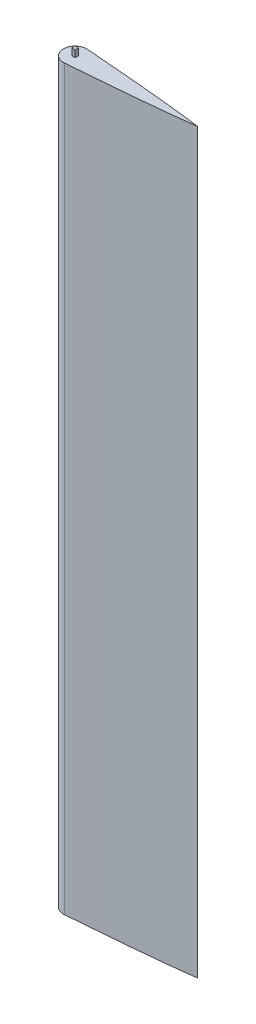
from build123d import *

# Parameters (mm, degrees)
SKETCH_2_W      = 1
SKETCH_2_H      = 1
EXTRUDE_1_DEPTH = 220
EXTRUDE_START   = -2
SKETCH_2_3_W    = 1
SKETCH_2_3_H    = 1
EXTRUDE_2_DEPTH = 224


with BuildPart() as part:
    # Эскиз2 → Бобышка-Вытянуть1 (new body)
    with BuildSketch(Plane(origin=(0, 0, 0), x_dir=(1, 0, 0), z_dir=(0, 1, 0))):
        with BuildLine():
            add(Edge.make_bspline(
                [(1083.771747789, 3.495536657), (1084.559015588, 3.435605975), (1086.260562943, 3.304284604), (1088.875963221, 3.096374786), (1091.617998939, 2.871404666), (1094.359683654, 2.639618173), (1097.101060652, 2.401201187), (1099.841752147, 2.156315779), (1102.580813649, 1.904550906), (1105.317070012, 1.645478536), (1108.049481509, 1.37722039), (1110.776487444, 1.097638633), (1113.487947613, 0.807843629), (1116.127835032, 0.505124451), (1118.294910337, 0.236043523), (1119.565652922, 0.060128694), (1120, 0)],
                knots=[0.700555661, 0.700555661, 0.700555661, 0.700555661, 0.720040806, 0.742672895, 0.76530453, 0.787938655, 0.810576078, 0.833214133, 0.855845421, 0.878458096, 0.901043958, 0.923602452, 0.946110354, 0.968340532, 0.989178613, 1, 1, 1, 1], degree=3))
            ThreePointArc((1083.771747789, 3.495536657), (1080, 1.743e-06), (1083.77174419, -3.495537054))
            add(Edge.make_bspline(
                [(1120, 0), (1119.565652922, -0.060128694), (1118.294910337, -0.236043523), (1116.127835032, -0.505124451), (1113.487947613, -0.807843629), (1110.776487444, -1.097638633), (1108.049481509, -1.37722039), (1105.317070012, -1.645478536), (1102.580813649, -1.904550906), (1099.841752147, -2.156315779), (1097.101060652, -2.401201187), (1094.359683654, -2.639618173), (1091.617998939, -2.871404666), (1088.089059882, -3.160936213), (1085.473428777, -3.365998247), (1083.77174419, -3.495537054)],
                knots=[0, 0, 0, 0, 0.010821387, 0.031659468, 0.053889646, 0.076397548, 0.098956042, 0.121541904, 0.144154579, 0.166785867, 0.189423922, 0.212061345, 0.23469547, 0.257327105, 0.299444369, 0.299444369, 0.299444369, 0.299444369], degree=3))
        make_face()
        with Locations((1083.505650406, -6.1e-08)):
            Rectangle(SKETCH_2_W, SKETCH_2_H, mode=Mode.SUBTRACT)
    extrude(amount=EXTRUDE_1_DEPTH)

    # Эскиз2<3> → Бобышка-Вытянуть2 (add)
    with BuildSketch(Plane(origin=(0, 0, 0), x_dir=(1, 0, 0), z_dir=(0, 1, 0)).offset(EXTRUDE_START)):
        with Locations((1083.505650406, -6.1e-08)):
            Rectangle(SKETCH_2_3_W, SKETCH_2_3_H)
    extrude(amount=EXTRUDE_2_DEPTH)


solid = part.part
